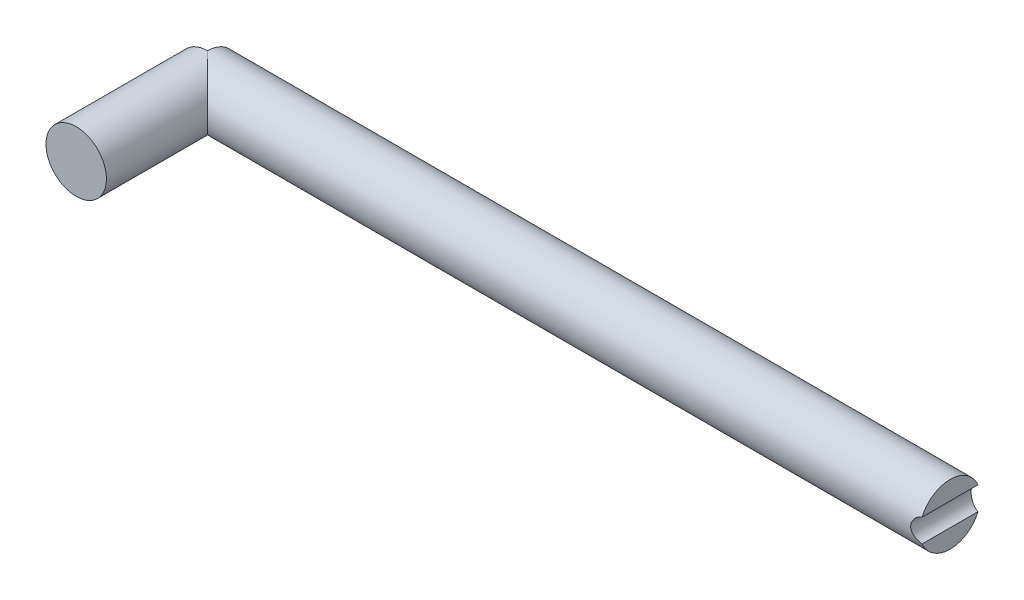
from build123d import *

# Parameters (mm, degrees)
SKETCH1_R                         = 23
LENGTH_DEPTH                      = 565
SKETCH2_R                         = 23
HIP_JOINT_DEPTH                   = 100
TIBIA_AXIS_REACH                  = 576.242
TIBIA_AXIS_END_RADIUS             = 23
SKETCH3_R                         = 9.071418029
TIBIA_AXIS_DIRECTION_2_REACH      = 576.242
TIBIA_AXIS_DIRECTION_2_END_RADIUS = 23


with BuildPart() as part:
    # Sketch1 → Length (new body)
    with BuildSketch(Plane(origin=(0, 0, 0), x_dir=(0, 0, -1), z_dir=(1, 0, 0))):
        Circle(SKETCH1_R)
    extrude(amount=LENGTH_DEPTH)

    # Sketch2 → Hip joint (add)
    with BuildSketch(Plane.XY):
        with Locations(Location((0, 0, 0), (0, 0, 270))):
            Circle(SKETCH2_R)
    extrude(amount=HIP_JOINT_DEPTH)

    # Tibia axis: up to this cylinder (the profile starts inside it)
    tibia_axis_end = Plane(origin=(567.07131, 0, 0), z_dir=(-1, 0, 0)) * Cylinder(TIBIA_AXIS_END_RADIUS, 1199.484, mode=Mode.PRIVATE)
    # Sketch3 → Tibia axis (cut, up to the surface)
    with BuildSketch(Plane.XY, mode=Mode.PRIVATE) as tibia_axis_sk1:
        with Locations((567.071310444, 0)):
            Circle(SKETCH3_R)
    tibia_axis_tool1 = extrude(tibia_axis_sk1.sketch, amount=-TIBIA_AXIS_REACH, mode=Mode.PRIVATE) & tibia_axis_end
    add(tibia_axis_tool1.solids().sort_by_distance((567.07131, 0, 0))[0], mode=Mode.SUBTRACT)

    # Tibia axis direction 2: up to this cylinder (the profile starts inside it)
    tibia_axis_direction_2_end = Plane(origin=(567.07131, 0, 0), z_dir=(-1, 0, 0)) * Cylinder(TIBIA_AXIS_DIRECTION_2_END_RADIUS, 1199.484, mode=Mode.PRIVATE)
    # Sketch3 → Tibia axis direction 2 (cut, up to the surface)
    with BuildSketch(Plane.XY, mode=Mode.PRIVATE) as tibia_axis_direction_2_sk1:
        with Locations((567.071310444, 0)):
            Circle(SKETCH3_R)
    tibia_axis_direction_2_tool1 = extrude(tibia_axis_direction_2_sk1.sketch, amount=TIBIA_AXIS_DIRECTION_2_REACH, mode=Mode.PRIVATE) & tibia_axis_direction_2_end
    add(tibia_axis_direction_2_tool1.solids().sort_by_distance((567.07131, 0, 0))[0], mode=Mode.SUBTRACT)


solid = part.part
